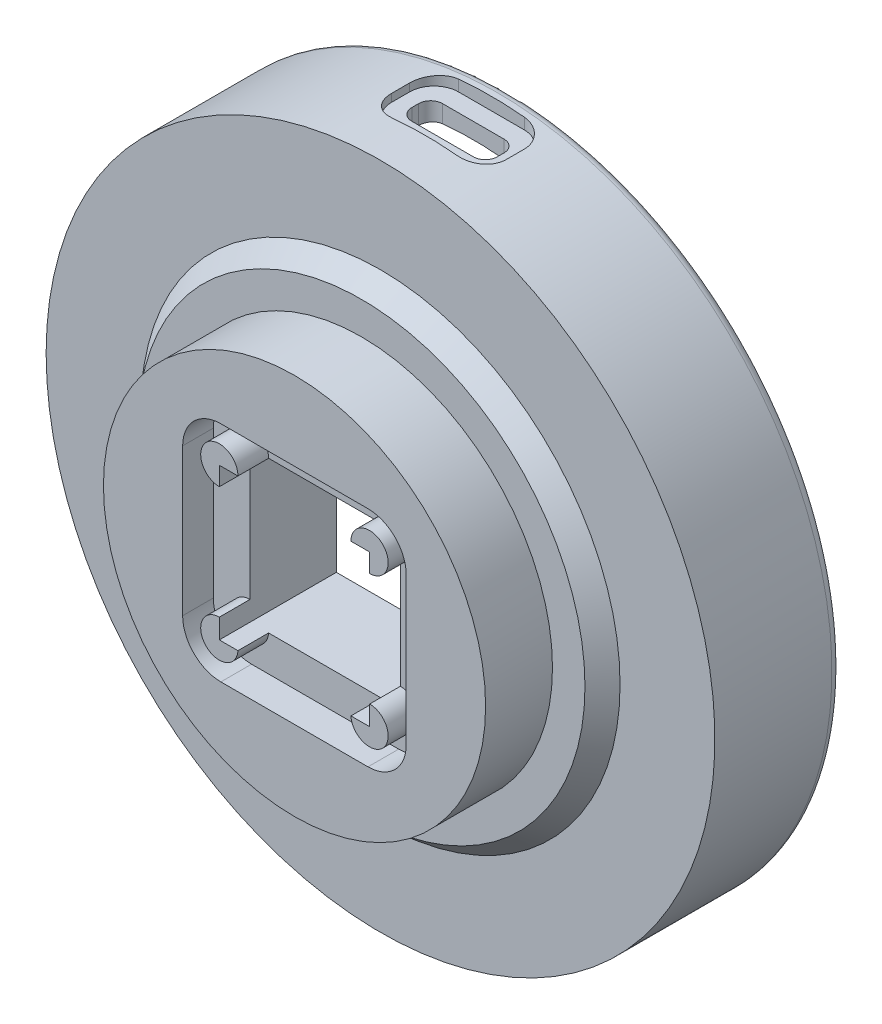
from build123d import *

# Parameters (mm, degrees)
SKETCH_2_R               = 20
EXTRUDE_1_DEPTH          = 10
CUT_EXTRUDE_START        = -3.21
SKETCH_3_R               = 1.95
CUT_EXTRUDE_1_DEPTH      = 3.21
SKETCH_4_R               = 1.95
EXTRUDE_2_DEPTH          = 3.21
EXTRUDE_5_DEPTH          = 12.25
EXTRUDE_5_DEPTH_BACK     = 1
SKETCH_11_R              = 35
SKETCH_14_R              = 32
CUT_EXTRUDE_3_DEPTH      = 10
SKETCH_15_R              = 33
CUT_EXTRUDE_4_DEPTH      = 2
CUT_EXTRUDE_5_DEPTH      = 10
CUT_EXTRUDE_6_DEPTH      = 2
CUT_EXTRUDE_6_DEPTH_BACK = 2
EXTRUDE_6_DEPTH          = 2
EXTRUDE_9_DEPTH          = 3.362823
CUT_EXTRUDE_8_DEPTH      = 5
SKETCH_25_W              = 15.740658342
SKETCH_25_H              = 15.835096482
CUT_EXTRUDE_9_DEPTH      = 15
SKETCH_26_W              = 1.494943783
SKETCH_26_H              = 11.950704804
SKETCH_26_W_2            = 4.74456779
SKETCH_26_H_2            = 1.568493223
SKETCH_26_W_3            = 7.014486442
SKETCH_26_H_3            = 1.553492486
SKETCH_26_W_4            = 1.799766322
SKETCH_26_H_4            = 8.355464242
EXTRUDE_10_DEPTH         = 8
SKETCH_28_W              = 5.367346996
SKETCH_28_H              = 7.839151532
EXTRUDE_11_DEPTH         = 2
SKETCH_29_W              = 1.7
SKETCH_29_H              = 12.872442774
SKETCH_29_H_2            = 12.7
SKETCH_29_W_2            = 5.781613905
SKETCH_29_H_3            = 1.733367437
EXTRUDE_12_DEPTH         = 3.25
SKETCH_30_W              = 1.544752331
SKETCH_30_H              = 5
SKETCH_30_W_2            = 4.319710911
SKETCH_30_H_2            = 1.632346374
SKETCH_30_W_3            = 3.974629604
SKETCH_30_H_3            = 1.690917675
EXTRUDE_13_DEPTH         = 1.6
CUT_EXTRUDE_11_DEPTH     = 5
SKETCH_33_R              = 2.925
SKETCH_33_R_2            = 1.425
EXTRUDE_15_DEPTH         = 4
FILLET_1_R               = 1


with BuildPart() as part:
    # 草图2 → 凸台-拉伸1 (new body)
    with BuildSketch(Plane.XY):
        Circle(SKETCH_2_R)
    extrude(amount=-EXTRUDE_1_DEPTH)

    # 草图3 → 切除-拉伸1 (cut)
    with BuildSketch(Plane.XY.offset(CUT_EXTRUDE_START)):
        with BuildLine():
            Line((-7.710329171, 11.757548241), (7.689670829, 11.757548241))
            ThreePointArc((7.689670829, 11.757548241), (10.518097953, 10.585975365), (11.689670829, 7.757548241))
            Line((11.689670829, 7.757548241), (11.689670829, -7.642451759))
            ThreePointArc((11.689670829, -7.642451759), (10.518097953, -10.470878884), (7.689670829, -11.642451759))
            Line((7.689670829, -11.642451759), (-7.710329171, -11.642451759))
            ThreePointArc((-7.710329171, -11.642451759), (-10.538756296, -10.470878884), (-11.710329171, -7.642451759))
            Line((-11.710329171, -7.642451759), (-11.710329171, 7.757548241))
            ThreePointArc((-11.710329171, 7.757548241), (-10.538756296, 10.585975365), (-7.710329171, 11.757548241))
        make_face()
        with Locations((7.849670829, -7.802451759)):
            Circle(SKETCH_3_R, mode=Mode.SUBTRACT)
        with Locations((7.849670829, 7.917548241)):
            Circle(SKETCH_3_R, mode=Mode.SUBTRACT)
        with Locations((-7.870329171, 7.917548241)):
            Circle(SKETCH_3_R, mode=Mode.SUBTRACT)
        with Locations((-7.870329171, -7.802451759)):
            Circle(SKETCH_3_R, mode=Mode.SUBTRACT)
    extrude(amount=CUT_EXTRUDE_1_DEPTH, mode=Mode.SUBTRACT)

    # 草图4 → 凸台-拉伸2 (add)
    with BuildSketch(Plane(origin=(0, 0, -3.21), x_dir=(-1, 0, 0), z_dir=(0, 0, -1))):
        with Locations(Location((7.870329171, 7.917548241, 0), (0, 0, 180))):
            Circle(SKETCH_4_R)
        with Locations(Location((7.870329171, -7.802451759, 0), (0, 0, 180))):
            Circle(SKETCH_4_R)
        with Locations(Location((-7.849670829, -7.802451759, 0), (0, 0, 180))):
            Circle(SKETCH_4_R)
        with Locations(Location((-7.849670829, 7.917548241, 0), (0, 0, 180))):
            Circle(SKETCH_4_R)
    extrude(amount=-EXTRUDE_2_DEPTH)

    # 草图10 → 旋转1 (revolve)
    with BuildSketch(Plane(origin=(0, 0, 0), x_dir=(1, 0, 0), z_dir=(0, 1, 0)), mode=Mode.PRIVATE) as revolve_1_sk:
        Polygon((-20, 7), (-23.400893257, 7), (-25.912132034, 10), (-23.400893257, 10), (-20, 10), align=None)
    revolve(revolve_1_sk.sketch.rotate(Axis((0, 0, 0), (0, 0, -1)), 180), axis=Axis((0, 0, 0), (0, 0, -1)))

    # 草图11 → 凸台-拉伸5 (add, two sides: drawn at the far end of the back side and taken through both)
    with BuildSketch(Plane(origin=(0, 0, -10), x_dir=(-1, 0, 0), z_dir=(0, 0, -1)).offset(-EXTRUDE_5_DEPTH_BACK)):
        Circle(SKETCH_11_R)
    extrude(amount=EXTRUDE_5_DEPTH + EXTRUDE_5_DEPTH_BACK)

    # 草图14 → 切除-拉伸3 (cut)
    with BuildSketch(Plane(origin=(0, 0, -22.25), x_dir=(-1, 0, 0), z_dir=(0, 0, -1))):
        Circle(SKETCH_14_R)
    extrude(amount=-CUT_EXTRUDE_3_DEPTH, mode=Mode.SUBTRACT)

    # 草图15 → 切除-拉伸4 (cut)
    with BuildSketch(Plane(origin=(0, 0, -22.25), x_dir=(-1, 0, 0), z_dir=(0, 0, -1))):
        Circle(SKETCH_15_R)
    extrude(amount=-CUT_EXTRUDE_4_DEPTH, mode=Mode.SUBTRACT)

    # 草图18 → 切除-拉伸5 (cut)
    with BuildSketch(Plane(origin=(0, 33.669137751, 0), x_dir=(1, 0, 0), z_dir=(0, 1, 0))):
        with BuildLine():
            Line((-3.446221995, 13.605), (3.446221995, 13.605))
            ThreePointArc((3.446221995, 13.605), (5.25201574, 14.35298426), (6, 16.158778005))
            Line((6, 16.158778005), (6, 18.051221995))
            ThreePointArc((6, 18.051221995), (5.25201574, 19.85701574), (3.446221995, 20.605))
            Line((3.446221995, 20.605), (-3.446221995, 20.605))
            ThreePointArc((-3.446221995, 20.605), (-5.25201574, 19.85701574), (-6, 18.051221995))
            Line((-6, 18.051221995), (-6, 16.158778005))
            ThreePointArc((-6, 16.158778005), (-5.25201574, 14.35298426), (-3.446221995, 13.605))
        make_face()
    extrude(amount=CUT_EXTRUDE_5_DEPTH, mode=Mode.SUBTRACT)

    # 草图19 → 切除-拉伸6 (cut, two sides: drawn at the far end of the back side and taken through both)
    with BuildSketch(Plane(origin=(0, 32.169137751, 0), x_dir=(1, 0, 0), z_dir=(0, 1, 0)).offset(-CUT_EXTRUDE_6_DEPTH_BACK)):
        with BuildLine():
            Line((-4.47, 16.75), (-4.47, 17.46))
            ThreePointArc((-4.47, 17.46), (-4.103883476, 18.343883477), (-3.22, 18.71))
            Line((-3.22, 18.71), (3.22, 18.71))
            ThreePointArc((3.22, 18.71), (4.103883476, 18.343883477), (4.47, 17.46))
            Line((4.47, 17.46), (4.47, 16.75))
            ThreePointArc((4.47, 16.75), (4.103883476, 15.866116524), (3.22, 15.5))
            Line((3.22, 15.5), (-3.22, 15.5))
            ThreePointArc((-3.22, 15.5), (-4.103883476, 15.866116524), (-4.47, 16.75))
        make_face()
    extrude(amount=CUT_EXTRUDE_6_DEPTH + CUT_EXTRUDE_6_DEPTH_BACK, mode=Mode.SUBTRACT)

    # 草图21 → 凸台-拉伸6 (add)
    with BuildSketch(Plane(origin=(0, 0, -12.25), x_dir=(-1, 0, 0), z_dir=(0, 0, -1))):
        Polygon((14.199016708, 7.776342203), (12.096695943, 10.938180832), (10.737208588, 10.034251558), (12.839529353, 6.872412929), align=None)
        Polygon((13.985003259, 13.648868589), (12.145919532, 12.426053524), (11.303680645, 13.692760058), (13.142764371, 14.915575122), align=None)
        Polygon((17.307106622, 8.652506988), (15.359059322, 7.357241551), (16.34390314, 5.876060715), (18.291950441, 7.171326152), align=None)
    extrude(amount=EXTRUDE_6_DEPTH)

    # 草图23 → 凸台-拉伸9 (add)
    with BuildSketch(Plane(origin=(0, 0, -12.25), x_dir=(-1, 0, 0), z_dir=(0, 0, -1))):
        Polygon((25.266454267, 12.360086641), (20.660534392, 19.463438627), (16.624004022, 16.846091845), (21.229923897, 9.742739859), align=None)
    extrude(amount=EXTRUDE_9_DEPTH)

    # 草图24 → 切除-拉伸8 (cut)
    with BuildSketch(Plane(origin=(-23.429974487, 15.192346569, 0), x_dir=(0, 0, 1), z_dir=(-0.8390507857009022, 0.5440531031201816, 0))):
        with BuildLine():
            Line((-14.049608608, 3.064207836), (-14.049608608, -1.009093434))
            add(Edge.make_bspline(
                [(-14.049608608, -1.009093434), (-14.049608608, -1.418314787), (-14.218081041, -1.825016223), (-14.796845842, -2.40374261), (-15.203574273, -2.572203861), (-15.612822788, -2.572203861)],
                knots=[0, 0, 0, 0, 0.5, 0.5, 1, 1, 1, 1], degree=3))
            Line((-15.612822788, -2.572203861), (-15.612822788, 4.627318263))
            add(Edge.make_bspline(
                [(-15.612822788, 4.627318263), (-15.203574273, 4.627318263), (-14.796845842, 4.458857013), (-14.218081041, 3.880130625), (-14.049608608, 3.473429189), (-14.049608608, 3.064207836)],
                knots=[0, 0, 0, 0, 0.5, 0.5, 1, 1, 1, 1], degree=3))
        make_face()
    extrude(amount=-CUT_EXTRUDE_8_DEPTH, mode=Mode.SUBTRACT)

    # 草图25 → 切除-拉伸9 (cut)
    with BuildSketch(Plane.XY):
        Rectangle(SKETCH_25_W, SKETCH_25_H)
    extrude(amount=-CUT_EXTRUDE_9_DEPTH, mode=Mode.SUBTRACT)

    # 草图26 → 凸台-拉伸10 (add)
    with BuildSketch(Plane(origin=(0, 0, -12.25), x_dir=(-1, 0, 0), z_dir=(0, 0, -1))):
        Polygon((9.744130588, -20.921254797), (-6.269813848, -20.861037188), (-6.275664277, -22.416868439), (9.738280159, -22.477086047), align=None)
        with Locations((-19.982694769, -9.269317614)):
            Rectangle(SKETCH_26_W, SKETCH_26_H)
        with Locations((10.242613066, 4.923209424)):
            Rectangle(SKETCH_26_W_2, SKETCH_26_H_2)
        with Locations((-11.377572392, 4.915709055)):
            Rectangle(SKETCH_26_W_3, SKETCH_26_H_3)
        with Locations((23.251391053, -7.187493346)):
            Rectangle(SKETCH_26_W_4, SKETCH_26_H_4)
    extrude(amount=EXTRUDE_10_DEPTH)

    # 草图28 → 凸台-拉伸11 (add)
    with BuildSketch(Plane(origin=(0, 0, -12.25), x_dir=(-1, 0, 0), z_dir=(0, 0, -1))):
        with Locations((1.789299339, 18.227729585)):
            Rectangle(SKETCH_28_W, SKETCH_28_H)
    extrude(amount=EXTRUDE_11_DEPTH)

    # 草图29 → 凸台-拉伸12 (add)
    with BuildSketch(Plane(origin=(0, 0, -12.25), x_dir=(-1, 0, 0), z_dir=(0, 0, -1))):
        with Locations((9.747325992, 20.187377988)):
            Rectangle(SKETCH_29_W, SKETCH_29_H)
        with Locations((-9.732674008, 20.101156601)):
            Rectangle(SKETCH_29_W, SKETCH_29_H_2)
        with Locations((3.315495595, 8.820472883)):
            Rectangle(SKETCH_29_W_2, SKETCH_29_H_3)
    extrude(amount=EXTRUDE_12_DEPTH)

    # 草图30 → 凸台-拉伸13 (add)
    with BuildSketch(Plane(origin=(0, 0, -12.25), x_dir=(-1, 0, 0), z_dir=(0, 0, -1))):
        with Locations((16.402055041, 23.104914485)):
            Rectangle(SKETCH_30_W, SKETCH_30_H)
        Polygon((-16.629511414, 17.434236314), (-16.640779994, 21.530429014), (-18.373740299, 21.52566166), (-18.362471719, 17.42946896), align=None)
        with Locations((-24.162588507, 13.3623941)):
            Rectangle(SKETCH_30_W_2, SKETCH_30_H_2)
        with Locations((-24.193835066, 5.700762076)):
            Rectangle(SKETCH_30_W_3, SKETCH_30_H_3)
    extrude(amount=EXTRUDE_13_DEPTH)

    # 草图32 → 切除-拉伸11 (cut)
    with BuildSketch(Plane(origin=(-29.695223518, 19.744488054, 0), x_dir=(0, 0, 1), z_dir=(-0.8327269333980879, 0.5536838939263238, 0))):
        with BuildLine():
            Line((-16.737951229, -3.077490577), (-15.538858253, -3.077490577))
            ThreePointArc((-15.538858253, -3.077490577), (-14.414237789, -2.611657528), (-13.948404741, -1.487037064))
            Line((-13.948404741, -1.487037064), (-13.948404741, 2.732055911))
            ThreePointArc((-13.948404741, 2.732055911), (-14.414237789, 3.856676375), (-15.538858253, 4.322509423))
            Line((-15.538858253, 4.322509423), (-16.737951229, 4.322509423))
            ThreePointArc((-16.737951229, 4.322509423), (-17.862571692, 3.856676375), (-18.328404741, 2.732055911))
            Line((-18.328404741, 2.732055911), (-18.328404741, -1.487037064))
            ThreePointArc((-18.328404741, -1.487037064), (-17.862571692, -2.611657528), (-16.737951229, -3.077490577))
        make_face()
    extrude(amount=-CUT_EXTRUDE_11_DEPTH, mode=Mode.SUBTRACT)

    # 草图33 → 凸台-拉伸15 (add)
    # profile 1 of 3: a face of its own
    with BuildSketch(Plane(origin=(0, 0, -12.25), x_dir=(-1, 0, 0), z_dir=(0, 0, -1))):
        with Locations((26.0034734, 9.296556496)):
            Circle(SKETCH_33_R)
        with Locations((26.0034734, 9.296556496)):
            Circle(SKETCH_33_R_2, mode=Mode.SUBTRACT)
    # profile 2 of 3: a face of its own
    with BuildSketch(Plane(origin=(0, 0, -12.25), x_dir=(-1, 0, 0), z_dir=(0, 0, -1))):
        with Locations((-4.950682607, -27.167946799)):
            Circle(SKETCH_33_R)
        with Locations((-4.950682607, -27.167946799)):
            Circle(SKETCH_33_R_2, mode=Mode.SUBTRACT)
    # profile 3 of 3: a face of its own
    with BuildSketch(Plane(origin=(0, 0, -12.25), x_dir=(-1, 0, 0), z_dir=(0, 0, -1))):
        with Locations(Location((-21.052790793, 17.871390303, 0), (0, 0, 23.326656476))):
            Circle(SKETCH_33_R)
        with Locations((-21.052790793, 17.871390303)):
            Circle(SKETCH_33_R_2, mode=Mode.SUBTRACT)
    extrude(amount=EXTRUDE_15_DEPTH)

    # 圆角1
    fillet_1_edges = [part.edges().sort_by_distance(p)[0] for p in [
        (35, 0, -22.25),
    ]]
    fillet(fillet_1_edges, radius=FILLET_1_R)


solid = part.part
